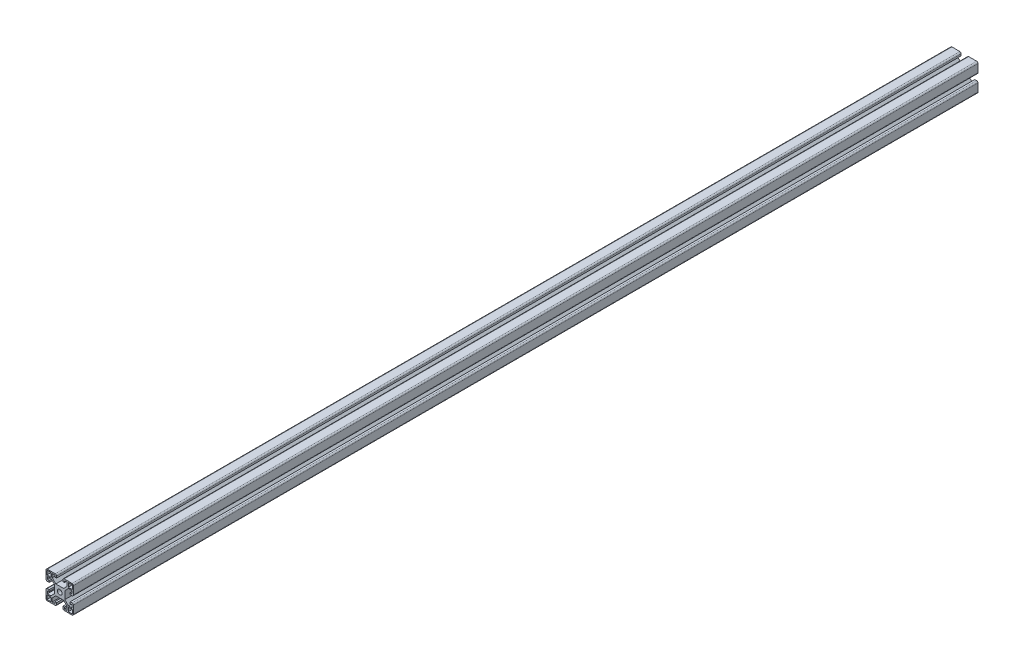
from build123d import *

# Parameters (mm, degrees)
CROQUIS1_W              = 40
CROQUIS1_H              = 40
SALIENTE_EXTRUIR1_DEPTH = 1320
CROQUIS2_W              = 6
CROQUIS2_H              = 6
CROQUIS2_R              = 3.5
CORTAR_EXTRUIR2_DEPTH   = 1320
REDONDEO1_R             = 2
REDONDEO2_R             = 2


with BuildPart() as part:
    # Croquis1 → Saliente-Extruir1 (new body)
    with BuildSketch(Plane.XY):
        Rectangle(CROQUIS1_W, CROQUIS1_H)
    extrude(amount=SALIENTE_EXTRUIR1_DEPTH)

    # Croquis2 → Cortar-Extruir2 (cut)
    with BuildSketch(Plane.XY.offset(1320)):
        with Locations((-15.5, 15.5)):
            Rectangle(CROQUIS2_W, CROQUIS2_H)
        Polygon((4.5, 15.5), (4.5, 20), (-4.5, 20), (-4.5, 15.5), (-7, 15.5), (-7, 18), (-11, 18), (-11, 12.767766953), (-5.733637236, 7.501404189), (5.733637236, 7.501404189), (11, 12.767766953), (11, 18), (7, 18), (7, 15.5), align=None)
        with Locations((15.5, 15.5)):
            Rectangle(CROQUIS2_W, CROQUIS2_H)
        Polygon((15.367588592, -4.5), (20, -4.5), (20, 4.5), (15.367588592, 4.5), (15.367588592, 7), (17.867588592, 7), (17.867588592, 11), (12.767766953, 11), (7.501349817, 5.733582864), (7.501349817, -5.733582864), (12.767766953, -11), (17.867588592, -11), (17.867588592, -7), (15.367588592, -7), align=None)
        Polygon((-20, 4.5), (-20, -4.5), (-15.367588592, -4.5), (-15.367588592, -7), (-17.867588592, -7), (-17.867588592, -11), (-12.767766953, -11), (-7.501349817, -5.733582864), (-7.501349817, 5.733582864), (-12.767766953, 11), (-17.867588592, 11), (-17.867588592, 7), (-15.367588592, 7), (-15.367588592, 4.5), align=None)
        Circle(CROQUIS2_R)
        Polygon((11, -12.767766953), (5.733637236, -7.501404189), (-5.733637236, -7.501404189), (-11, -12.767766953), (-11, -18), (-7, -18), (-7, -15.5), (-4.5, -15.5), (-4.5, -20), (4.5, -20), (4.5, -15.5), (7, -15.5), (7, -18), (11, -18), align=None)
        with Locations((-15.5, -15.5)):
            Rectangle(CROQUIS2_W, CROQUIS2_H)
        with Locations((15.5, -15.5)):
            Rectangle(CROQUIS2_W, CROQUIS2_H)
    extrude(amount=-CORTAR_EXTRUIR2_DEPTH, mode=Mode.SUBTRACT)

    # Redondeo1
    redondeo1_edges = [part.edges().sort_by_distance(p)[0] for p in [
        (20, -20, 660),
        (-20, -20, 660),
        (-20, 20, 660),
        (20, 20, 660),
    ]]
    fillet(redondeo1_edges, radius=REDONDEO1_R)

    # Redondeo2
    redondeo2_edges = [part.edges().sort_by_distance(p)[0] for p in [
        (4.5, 20, 660),
        (-4.5, 20, 660),
        (20, -4.5, 660),
        (20, 4.5, 660),
        (-20, 4.5, 660),
        (-20, -4.5, 660),
        (-4.5, -20, 660),
        (4.5, -20, 660),
    ]]
    fillet(redondeo2_edges, radius=REDONDEO2_R)


solid = part.part
